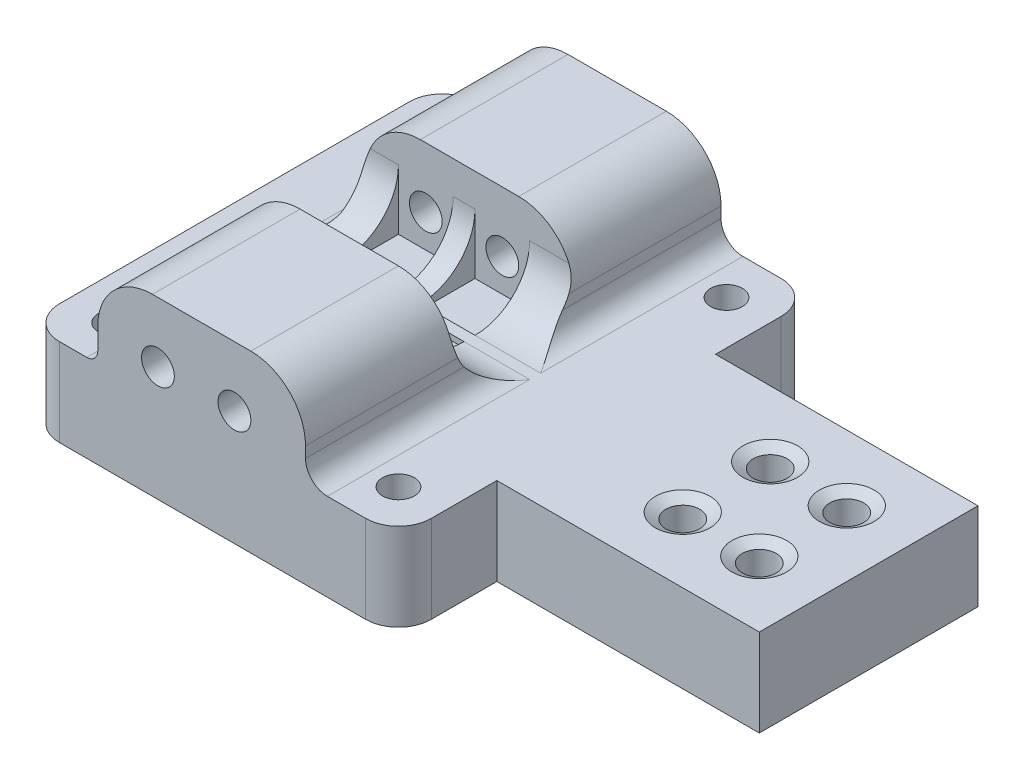
from build123d import *

# Parameters (mm, degrees)
SKETCH1_W                 = 300
SKETCH1_H                 = 20
BOSS_EXTRUDE1_DEPTH       = 8
SKETCH2_W                 = 34
SKETCH2_H                 = 8
BOSS_EXTRUDE2_DEPTH       = 9
SKETCH3_W                 = 34
SKETCH3_H                 = 8
BOSS_EXTRUDE3_DEPTH       = 9
SKETCH4_R                 = 1.45
CUT_EXTRUDE1_DEPTH        = 302.504560496
SKETCH5_W                 = 25
SKETCH5_H                 = 8
BOSS_EXTRUDE4_DEPTH       = 17
SKETCH6_W                 = 25
SKETCH6_H                 = 8
BOSS_EXTRUDE5_DEPTH       = 17
SKETCH12_W                = 8
SKETCH12_H                = 8
BOSS_EXTRUDE7_DEPTH       = 17
BOSS_EXTRUDE8_DEPTH       = 12
SKETCH15_R                = 1.6
CUT_EXTRUDE7_DEPTH        = 20
SKETCH16_W                = 20
SKETCH16_H                = 13
BOSS_EXTRUDE9_DEPTH       = 12
SKETCH17_R                = 1.6
CUT_EXTRUDE8_DEPTH        = 20
SKETCH22_W                = 10
SKETCH22_H                = 38
CUT_EXTRUDE11_DEPTH       = 306.0983448
SKETCH23_W                = 8
SKETCH23_H                = 18
CUT_EXTRUDE12_DEPTH       = 4
BOSS_EXTRUDE12_DEPTH      = 10
BOSS_EXTRUDE13_DEPTH      = 8
SKETCH26_W                = 8
SKETCH26_H                = 48
BOSS_EXTRUDE14_DEPTH      = 14
SKETCH27_W                = 8
SKETCH27_H                = 16
BOSS_EXTRUDE15_DEPTH      = 14
SKETCH28_W                = 8
SKETCH28_H                = 40
CUT_EXTRUDE13_DEPTH       = 14
SKETCH30_W                = 16
SKETCH30_H                = 14
BOSS_EXTRUDE16_DEPTH      = 9
SKETCH31_W                = 17
SKETCH31_H                = 8
CUT_EXTRUDE14_DEPTH       = 5
SKETCH32_W                = 16
SKETCH32_H                = 9
CUT_EXTRUDE15_DEPTH       = 9
CUT_EXTRUDE16_DEPTH       = 10
SKETCH34_W                = 7
SKETCH34_H                = 5
CUT_EXTRUDE17_DEPTH       = 5
SKETCH35_W                = 7
SKETCH35_H                = 5
BOSS_EXTRUDE17_DEPTH      = 5
SKETCH36_R                = 1.7
CUT_EXTRUDE18_DEPTH       = 307.014705529
SKETCH37_W                = 70
SKETCH37_H                = 8
BOSS_EXTRUDE18_DEPTH      = 5
SKETCH39_W                = 66
SKETCH39_H                = 6
CUT_EXTRUDE19_DEPTH       = 306.14258962
SKETCH46_W                = 20
SKETCH46_H                = 12
SKETCH46_W_2              = 19.974984355
BOSS_EXTRUDE23_DEPTH      = 10
BOSS_EXTRUDE24_DEPTH      = 5
BOSS_EXTRUDE24_DEPTH_BACK = 5
SKETCH47_W                = 28
SKETCH47_H                = 12
SKETCH47_W_2              = 28.025015645
SKETCH48_R                = 1.5
CUT_EXTRUDE22_DEPTH       = 15
SKETCH49_R                = 1.45
CUT_EXTRUDE23_DEPTH       = 309.139578763
SKETCH50_W                = 96.54170444
SKETCH50_H                = 99.159492098
CUT_EXTRUDE24_DEPTH       = 245
SKETCH51_R                = 1.55
CUT_EXTRUDE25_DEPTH       = 66.337584896
SKETCH52_W                = 19
SKETCH52_H                = 13.5
BOSS_EXTRUDE25_DEPTH      = 8
FILLET1_R                 = 5
SKETCH53_R                = 1.5
CUT_EXTRUDE26_DEPTH       = 72.161787499
FILLET2_R                 = 5
FILLET3_R                 = 3
SKETCH54_W                = 5
SKETCH54_H                = 5
CUT_EXTRUDE27_DEPTH       = 8.5
FILLET4_R                 = 1
FILLET5_R                 = 2


with BuildPart() as part:
    # Sketch1 → Boss-Extrude1 (new body)
    with BuildSketch(Plane(origin=(0, 0, 0), x_dir=(1, 0, 0), z_dir=(0, 1, 0))):
        with Locations((150, -10)):
            Rectangle(SKETCH1_W, SKETCH1_H)
    extrude(amount=BOSS_EXTRUDE1_DEPTH)

    # Sketch2 → Boss-Extrude2 (add)
    with BuildSketch(Plane.XY.offset(20)):
        with Locations((17, 4)):
            Rectangle(SKETCH2_W, SKETCH2_H)
        with Locations((283, 4)):
            Rectangle(SKETCH2_W, SKETCH2_H)
    extrude(amount=BOSS_EXTRUDE2_DEPTH)

    # Sketch3 → Boss-Extrude3 (add)
    with BuildSketch(Plane(origin=(0, 0, 0), x_dir=(-1, 0, 0), z_dir=(0, 0, -1))):
        with Locations((-17, 4)):
            Rectangle(SKETCH3_W, SKETCH3_H)
        with Locations((-283, 4)):
            Rectangle(SKETCH3_W, SKETCH3_H)
    extrude(amount=BOSS_EXTRUDE3_DEPTH)

    # Sketch4 → Cut-Extrude1 (cut, through all)
    with BuildSketch(Plane(origin=(0, 8, 0), x_dir=(1, 0, 0), z_dir=(0, 1, 0))):
        with Locations(Location((4, 5, 0), (0, 0, 270))):
            Circle(SKETCH4_R)
        with Locations(Location((30, 5, 0), (0, 0, 270))):
            Circle(SKETCH4_R)
        with Locations(Location((30, -25, 0), (0, 0, 270))):
            Circle(SKETCH4_R)
        with Locations(Location((4, -25, 0), (0, 0, 270))):
            Circle(SKETCH4_R)
        with Locations(Location((296, -25, 0), (0, 0, 270))):
            Circle(SKETCH4_R)
        with Locations(Location((296, 5, 0), (0, 0, 270))):
            Circle(SKETCH4_R)
        with Locations(Location((270, -25, 0), (0, 0, 270))):
            Circle(SKETCH4_R)
        with Locations(Location((270, 5, 0), (0, 0, 270))):
            Circle(SKETCH4_R)
    extrude(amount=-CUT_EXTRUDE1_DEPTH, mode=Mode.SUBTRACT)

    # Sketch5 → Boss-Extrude4 (add)
    with BuildSketch(Plane.XY.offset(20)):
        with Locations((253.5, 4)):
            Rectangle(SKETCH5_W, SKETCH5_H)
    extrude(amount=BOSS_EXTRUDE4_DEPTH)

    # Sketch6 → Boss-Extrude5 (add)
    with BuildSketch(Plane(origin=(0, 0, 0), x_dir=(-1, 0, 0), z_dir=(0, 0, -1))):
        with Locations((-253.5, 4)):
            Rectangle(SKETCH6_W, SKETCH6_H)
    extrude(amount=BOSS_EXTRUDE5_DEPTH)

    # Sketch12 → Boss-Extrude7 (add)
    with BuildSketch(Plane.XY.offset(37)):
        with Locations((245, 4)):
            Rectangle(SKETCH12_W, SKETCH12_H)
    extrude(amount=BOSS_EXTRUDE7_DEPTH)

    # Sketch14 → Boss-Extrude8 (add)
    with BuildSketch(Plane.XY.offset(29)):
        Polygon((294.974984355, 8), (275, 8), (275, -4), (294.974984355, -5), align=None)
    extrude(amount=BOSS_EXTRUDE8_DEPTH)

    # Sketch15 → Cut-Extrude7 (cut)
    with BuildSketch(Plane(origin=(294.974984355, 0, 0), x_dir=(0, 0, -1), z_dir=(1, 0, 0))):
        with Locations((-35, 0)):
            Circle(SKETCH15_R)
    extrude(amount=-CUT_EXTRUDE7_DEPTH, mode=Mode.SUBTRACT)

    # Sketch16 → Boss-Extrude9 (add)
    with BuildSketch(Plane(origin=(0, 0, -9), x_dir=(-1, 0, 0), z_dir=(0, 0, -1))):
        with Locations((-285, 1.5)):
            Rectangle(SKETCH16_W, SKETCH16_H)
    extrude(amount=BOSS_EXTRUDE9_DEPTH)

    # Sketch17 → Cut-Extrude8 (cut)
    with BuildSketch(Plane(origin=(295, 0, 0), x_dir=(0, 0, -1), z_dir=(1, 0, 0))):
        with Locations((15, 0)):
            Circle(SKETCH17_R)
    extrude(amount=-CUT_EXTRUDE8_DEPTH, mode=Mode.SUBTRACT)

    # Sketch22 → Cut-Extrude11 (cut, through all)
    with BuildSketch(Plane(origin=(0, 8, 0), x_dir=(1, 0, 0), z_dir=(0, 1, 0))):
        with Locations((254, -10)):
            Rectangle(SKETCH22_W, SKETCH22_H)
    extrude(amount=-CUT_EXTRUDE11_DEPTH, mode=Mode.SUBTRACT)

    # Sketch23 → Cut-Extrude12 (cut)
    with BuildSketch(Plane(origin=(0, 0, 0), x_dir=(-1, 0, 0), z_dir=(0, -1, 0))):
        with Locations((-263, -10)):
            Rectangle(SKETCH23_W, SKETCH23_H)
    extrude(amount=-CUT_EXTRUDE12_DEPTH, mode=Mode.SUBTRACT)

    # Sketch24 → Boss-Extrude12 (add)
    with BuildSketch(Plane.ZY.offset(-259)):
        Polygon((-9, 0), (-9, 8), (-1, 8), align=None)
        Polygon((29, 0), (29, 8), (21, 8), align=None)
    extrude(amount=BOSS_EXTRUDE12_DEPTH)

    # Sketch25 → Boss-Extrude13 (add)
    with BuildSketch(Plane.ZY.offset(-267)):
        Polygon((19, 0), (19, 4), (15, 4), align=None)
        Polygon((1, 4), (5, 4), (1, 0), align=None)
    extrude(amount=BOSS_EXTRUDE13_DEPTH)

    # Sketch26 → Boss-Extrude14 (add)
    with BuildSketch(Plane(origin=(0, 8, 0), x_dir=(1, 0, 0), z_dir=(0, 1, 0))):
        with Locations((245, -30)):
            Rectangle(SKETCH26_W, SKETCH26_H)
    extrude(amount=BOSS_EXTRUDE14_DEPTH)

    # Sketch27 → Boss-Extrude15 (add)
    with BuildSketch(Plane(origin=(0, 8, 0), x_dir=(1, 0, 0), z_dir=(0, 1, 0))):
        with Locations((253, -29)):
            Rectangle(SKETCH27_W, SKETCH27_H)
    extrude(amount=BOSS_EXTRUDE15_DEPTH)

    # Sketch28 → Cut-Extrude13 (cut)
    with BuildSketch(Plane.XZ):
        with Locations((245, 34)):
            Rectangle(SKETCH28_W, SKETCH28_H)
    extrude(amount=-CUT_EXTRUDE13_DEPTH, mode=Mode.SUBTRACT)

    # Sketch30 → Boss-Extrude16 (add)
    with BuildSketch(Plane(origin=(257, 0, 0), x_dir=(0, 0, -1), z_dir=(1, 0, 0))):
        with Locations((-29, 15)):
            Rectangle(SKETCH30_W, SKETCH30_H)
    extrude(amount=BOSS_EXTRUDE16_DEPTH)

    # Sketch31 → Cut-Extrude14 (cut)
    with BuildSketch(Plane(origin=(0, 0, 0), x_dir=(-1, 0, 0), z_dir=(0, -1, 0))):
        with Locations((-257.5, -33)):
            Rectangle(SKETCH31_W, SKETCH31_H)
    extrude(amount=-CUT_EXTRUDE14_DEPTH, mode=Mode.SUBTRACT)

    # Sketch32 → Cut-Extrude15 (cut)
    with BuildSketch(Plane(origin=(266, 0, 0), x_dir=(0, 0, -1), z_dir=(1, 0, 0))):
        with Locations((-29, 17.5)):
            Rectangle(SKETCH32_W, SKETCH32_H)
    extrude(amount=-CUT_EXTRUDE15_DEPTH, mode=Mode.SUBTRACT)

    # Sketch33 → Cut-Extrude16 (cut)
    with BuildSketch(Plane.ZY.offset(-249)):
        Polygon((29, 5), (24, 5), (29, 0), align=None)
    extrude(amount=-CUT_EXTRUDE16_DEPTH, mode=Mode.SUBTRACT)

    # Sketch34 → Cut-Extrude17 (cut)
    with BuildSketch(Plane.XY.offset(29)):
        with Locations((262.5, 2.5)):
            Rectangle(SKETCH34_W, SKETCH34_H)
    extrude(amount=-CUT_EXTRUDE17_DEPTH, mode=Mode.SUBTRACT)

    # Sketch35 → Boss-Extrude17 (add)
    with BuildSketch(Plane(origin=(0, 0, 21), x_dir=(-1, 0, 0), z_dir=(0, 0, -1))):
        with Locations((-262.5, 10.5)):
            Rectangle(SKETCH35_W, SKETCH35_H)
    extrude(amount=BOSS_EXTRUDE17_DEPTH)

    # Sketch36 → Cut-Extrude18 (cut, through all)
    with BuildSketch(Plane(origin=(0, 22, 0), x_dir=(1, 0, 0), z_dir=(0, 1, 0))):
        with Locations(Location((245, -50, 0), (0, 0, 270))):
            Circle(SKETCH36_R)
        with Locations(Location((245, -18, 0), (0, 0, 270))):
            Circle(SKETCH36_R)
    extrude(amount=-CUT_EXTRUDE18_DEPTH, mode=Mode.SUBTRACT)

    # Sketch37 → Boss-Extrude18 (add)
    with BuildSketch(Plane(origin=(0, 8, 0), x_dir=(1, 0, 0), z_dir=(0, 1, 0))):
        with Locations((206, -10)):
            Rectangle(SKETCH37_W, SKETCH37_H)
    extrude(amount=BOSS_EXTRUDE18_DEPTH)

    # Sketch39 → Cut-Extrude19 (cut, through all)
    with BuildSketch(Plane(origin=(0, 8, 0), x_dir=(1, 0, 0), z_dir=(0, 1, 0))):
        with Locations((208, -17)):
            Rectangle(SKETCH39_W, SKETCH39_H)
    extrude(amount=-CUT_EXTRUDE19_DEPTH, mode=Mode.SUBTRACT)

    # Sketch46 → Boss-Extrude23 (add)
    with BuildSketch(Plane(origin=(0, 8, 0), x_dir=(1, 0, 0), z_dir=(0, 1, 0))):
        with Locations((285, 15)):
            Rectangle(SKETCH46_W, SKETCH46_H)
        with Locations((284.987492178, -35)):
            Rectangle(SKETCH46_W_2, SKETCH46_H)
    extrude(amount=BOSS_EXTRUDE23_DEPTH)

    # Sketch47 → Boss-Extrude24 (add, two sides: drawn at the far end of the back side and taken through both)
    with BuildSketch(Plane(origin=(0, 18, 0), x_dir=(1, 0, 0), z_dir=(0, 1, 0)).offset(-BOSS_EXTRUDE24_DEPTH_BACK)):
        with Locations((289, 15)):
            Rectangle(SKETCH47_W, SKETCH47_H)
        with Locations((288.987492178, -35)):
            Rectangle(SKETCH47_W_2, SKETCH47_H)
    extrude(amount=BOSS_EXTRUDE24_DEPTH + BOSS_EXTRUDE24_DEPTH_BACK)

    # Sketch48 → Cut-Extrude22 (cut)
    with BuildSketch(Plane(origin=(303, 0, 0), x_dir=(0, 0, -1), z_dir=(1, 0, 0))):
        with Locations((16, 18)):
            Circle(SKETCH48_R)
        with Locations((-36, 18)):
            Circle(SKETCH48_R)
    extrude(amount=-CUT_EXTRUDE22_DEPTH, mode=Mode.SUBTRACT)

    # Sketch49 → Cut-Extrude23 (cut, through all)
    with BuildSketch(Plane(origin=(0, 8, 0), x_dir=(1, 0, 0), z_dir=(0, 1, 0))):
        with Locations(Location((78, -8, 0), (0, 0, 270))):
            Circle(SKETCH49_R)
        with Locations(Location((78, -12, 0), (0, 0, 270))):
            Circle(SKETCH49_R)
    extrude(amount=-CUT_EXTRUDE23_DEPTH, mode=Mode.SUBTRACT)

    # Sketch50 → Cut-Extrude24 (cut)
    with BuildSketch(Plane(origin=(303, 0, 0), x_dir=(0, 0, -1), z_dir=(1, 0, 0))):
        with Locations((-19.562356109, -1.790710069)):
            Rectangle(SKETCH50_W, SKETCH50_H)
    extrude(amount=-CUT_EXTRUDE24_DEPTH, mode=Mode.SUBTRACT)

    # Sketch51 → Cut-Extrude25 (cut, through all)
    with BuildSketch(Plane(origin=(0, 8, 0), x_dir=(1, 0, 0), z_dir=(0, 1, 0))):
        with Locations(Location((52, -14, 0), (0, 0, 270))):
            Circle(SKETCH51_R)
        with Locations(Location((45, -14, 0), (0, 0, 270))):
            Circle(SKETCH51_R)
        with Locations(Location((45, -6, 0), (0, 0, 270))):
            Circle(SKETCH51_R)
        with Locations(Location((52, -6, 0), (0, 0, 270))):
            Circle(SKETCH51_R)
    extrude(amount=-CUT_EXTRUDE25_DEPTH, mode=Mode.SUBTRACT)

    # Sketch52 → Boss-Extrude25 (add)
    with BuildSketch(Plane(origin=(0, 8, 0), x_dir=(1, 0, 0), z_dir=(0, 1, 0))):
        with Locations((16, 2.25)):
            Rectangle(SKETCH52_W, SKETCH52_H)
        with Locations((16, -22.25)):
            Rectangle(SKETCH52_W, SKETCH52_H)
    extrude(amount=BOSS_EXTRUDE25_DEPTH)

    # Fillet1
    fillet1_edges = [part.edges().sort_by_distance(p)[0] for p in [
        (16, 8, 4.5),
        (16, 8, 15.5),
    ]]
    fillet(fillet1_edges, radius=FILLET1_R)

    # Sketch53 → Cut-Extrude26 (cut, through all)
    with BuildSketch(Plane(origin=(0, 0, -9), x_dir=(-1, 0, 0), z_dir=(0, 0, -1))):
        with Locations((-19, 10.5)):
            Circle(SKETCH53_R)
        with Locations((-12, 10.5)):
            Circle(SKETCH53_R)
    extrude(amount=-CUT_EXTRUDE26_DEPTH, mode=Mode.SUBTRACT)

    # Fillet2
    fillet2_edges = [part.edges().sort_by_distance(p)[0] for p in [
        (25.5, 16, 22.25),
        (6.5, 16, 22.25),
        (6.5, 16, -2.25),
        (25.5, 16, -2.25),
    ]]
    fillet(fillet2_edges, radius=FILLET2_R)

    # Fillet3
    fillet3_edges = [part.edges().sort_by_distance(p)[0] for p in [
        (0, 4, 29),
        (34, 4, 29),
        (0, 4, -9),
        (34, 4, -9),
    ]]
    fillet(fillet3_edges, radius=FILLET3_R)

    # Sketch54 → Cut-Extrude27 (cut)
    with BuildSketch(Plane(origin=(0, 16, 0), x_dir=(1, 0, 0), z_dir=(0, 1, 0))):
        with Locations((19, -7)):
            Rectangle(SKETCH54_W, SKETCH54_H)
        with Locations((12, -7)):
            Rectangle(SKETCH54_W, SKETCH54_H)
        with Locations((19, -13)):
            Rectangle(SKETCH54_W, SKETCH54_H)
        with Locations((12, -13)):
            Rectangle(SKETCH54_W, SKETCH54_H)
    extrude(amount=-CUT_EXTRUDE27_DEPTH, mode=Mode.SUBTRACT)

    # Fillet4
    fillet4_edges = [part.edges().sort_by_distance(p)[0] for p in [
        (6.5, 8, 0.25),
        (6.5, 8, 19.75),
    ]]
    fillet(fillet4_edges, radius=FILLET4_R)

    # Fillet5
    fillet5_edges = [part.edges().sort_by_distance(p)[0] for p in [
        (25.5, 8, 0.25),
        (25.5, 8, 19.75),
    ]]
    fillet(fillet5_edges, radius=FILLET5_R)

    # Cut-Extrude28 cone 1 section (through the dimple's axis) → Cut-Extrude28 (revolve, cut)
    with BuildSketch(Plane(origin=(45, 8, 6), x_dir=(0, 0, 1), z_dir=(1, 0, 0))):
        Polygon((0, 0), (2.5, 0), (0, 1.443375673), align=None)
    revolve(axis=Axis((45, 8, 6), (0, -1, 0)), mode=Mode.SUBTRACT)

    # Cut-Extrude28 cone 2 section (through the dimple's axis) → Cut-Extrude28 cone 2 (revolve, cut)
    with BuildSketch(Plane(origin=(52, 8, 6), x_dir=(0, 0, 1), z_dir=(1, 0, 0))):
        Polygon((0, 0), (2.5, 0), (0, 1.443375673), align=None)
    revolve(axis=Axis((52, 8, 6), (0, -1, 0)), mode=Mode.SUBTRACT)

    # Cut-Extrude28 cone 3 section (through the dimple's axis) → Cut-Extrude28 cone 3 (revolve, cut)
    with BuildSketch(Plane(origin=(52, 8, 14), x_dir=(0, 0, 1), z_dir=(1, 0, 0))):
        Polygon((0, 0), (2.5, 0), (0, 1.443375673), align=None)
    revolve(axis=Axis((52, 8, 14), (0, -1, 0)), mode=Mode.SUBTRACT)

    # Cut-Extrude28 cone 4 section (through the dimple's axis) → Cut-Extrude28 cone 4 (revolve, cut)
    with BuildSketch(Plane(origin=(45, 8, 14), x_dir=(0, 0, 1), z_dir=(1, 0, 0))):
        Polygon((0, 0), (2.5, 0), (0, 1.443375673), align=None)
    revolve(axis=Axis((45, 8, 14), (0, -1, 0)), mode=Mode.SUBTRACT)


solid = part.part
